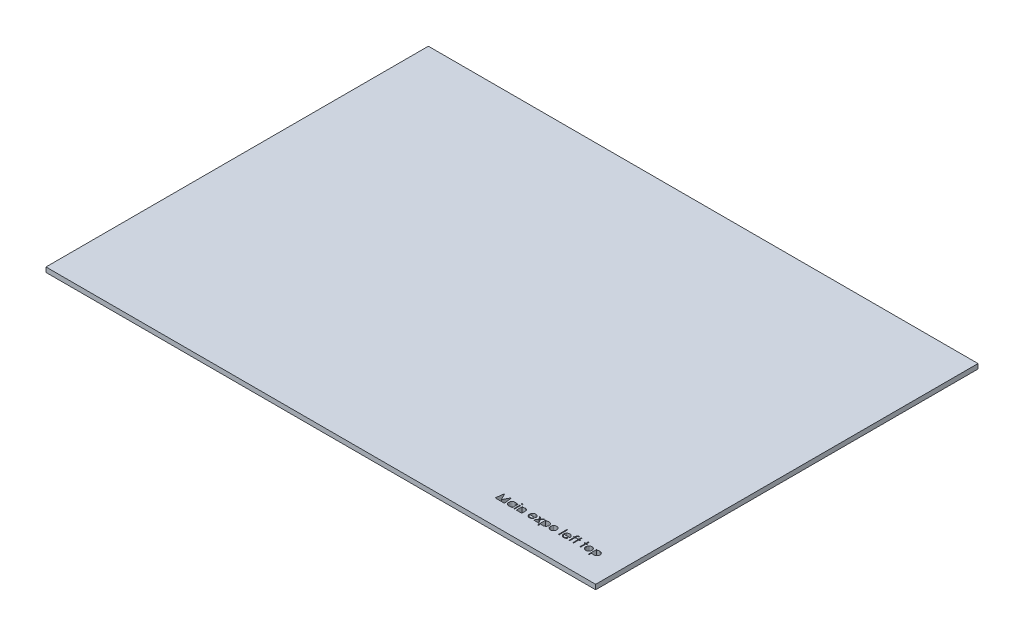
from build123d import *

# Parameters (mm, degrees)
SKETCH1_W           = 230
SKETCH1_H           = 160
SKETCH1_W_2         = 0.314102564
SKETCH1_H_2         = 2.557692307
SKETCH1_W_3         = 0.314102565
SKETCH1_H_3         = 3.589743589
BOSS_EXTRUDE1_DEPTH = 2


with BuildPart() as part:
    # Sketch1 → Boss-Extrude1 (new body)
    with BuildSketch(Plane(origin=(0, 0, 0), x_dir=(1, 0, 0), z_dir=(0, 1, 0))):
        with Locations((115, -80)):
            Rectangle(SKETCH1_W, SKETCH1_H)
        Polygon((177.965507038, -149.71486865), (177.649301108, -149.71486865), (178.111340371, -146.21486865), (178.156212166, -146.21486865), (179.601224185, -149.086663522), (181.042730595, -146.21486865), (181.088303512, -146.21486865), (181.553147262, -149.71486865), (181.237642454, -149.71486865), (179.639084762, -149.71486865), (179.568271461, -149.71486865), align=None, mode=Mode.SUBTRACT)
        with BuildLine():
            add(Edge.make_bspline(
                [(183.425142454, -149.759740445), (183.336113043, -149.759522346), (183.216101969, -149.749093024), (183.099102351, -149.722688544), (183.069311792, -149.71486865)],
                knots=[0, 0, 0, 0, 0.127433484, 0.171490765, 0.171490765, 0.171490765, 0.171490765], degree=3))
            add(Edge.make_bspline(
                [(183.069311792, -149.71486865), (183.057469644, -149.711760138), (183.004620061, -149.69710417), (182.912505577, -149.665310891), (182.796833202, -149.609718503), (182.685773164, -149.543180406), (182.579900472, -149.463938709), (182.480828873, -149.37335092), (182.389597111, -149.274955872), (182.309534977, -149.170010329), (182.242785029, -149.058968068), (182.186953348, -148.943234741), (182.144000303, -148.821920471), (182.103323727, -148.65121329), (182.091816793, -148.518517635), (182.0916088, -148.429011279)],
                knots=[0.171490765, 0.171490765, 0.171490765, 0.171490765, 0.189004127, 0.249930071, 0.310668454, 0.372328961, 0.43493911, 0.499575544, 0.564191208, 0.626735217, 0.688109334, 0.749293607, 0.810330528, 0.87190117, 1, 1, 1, 1], degree=3))
            add(Edge.make_bspline(
                [(182.0916088, -148.429011279), (182.092126454, -148.341193515), (182.102857929, -148.210578964), (182.14485376, -148.042846948), (182.188362727, -147.923491683), (182.244215073, -147.809151185), (182.312140332, -147.699747278), (182.392160243, -147.59497786), (182.484412433, -147.497306591), (182.584347254, -147.407086167), (182.691256, -147.328676426), (182.802479175, -147.260962097), (182.919742592, -147.207299322), (183.041308172, -147.163925058), (183.212520806, -147.123245573), (183.345544927, -147.11310217), (183.434958159, -147.112304548)],
                knots=[0, 0, 0, 0, 0.12607881, 0.186904093, 0.247573935, 0.308003356, 0.369131898, 0.432033228, 0.496790794, 0.561610823, 0.624913866, 0.686726349, 0.748078833, 0.809582291, 0.871630743, 1, 1, 1, 1], degree=3))
            add(Edge.make_bspline(
                [(183.434958159, -147.112304548), (183.537150843, -147.112603518), (183.688894174, -147.125723583), (183.88089195, -147.179702517), (184.015555025, -147.23356415), (184.142691575, -147.305254967), (184.304614576, -147.428409107), (184.407883974, -147.545475683), (184.469813929, -147.630433554)],
                knots=[0, 0, 0, 0, 0.254653531, 0.376014554, 0.495255252, 0.614797719, 0.738105554, 1, 1, 1, 1], degree=3))
            Line((184.469813929, -147.630433554), (184.469813929, -147.157176343))
            Line((184.469813929, -147.157176343), (184.783916493, -147.157176343))
            Line((184.783916493, -147.157176343), (184.783916493, -149.71486865))
            Line((184.783916493, -149.71486865), (184.469813929, -149.71486865))
            Line((184.469813929, -149.71486865), (183.790278782, -149.71486865))
            add(Edge.make_bspline(
                [(183.790278782, -149.71486865), (183.768256051, -149.720549885), (183.648428679, -149.748328797), (183.525378634, -149.760547796), (183.425142454, -149.759740445)],
                knots=[0.69099225, 0.69099225, 0.69099225, 0.69099225, 0.748144942, 1, 1, 1, 1], degree=3))
        make_face(mode=Mode.SUBTRACT)
        with Locations((185.614044698, -148.436022497)):
            Rectangle(SKETCH1_W_2, SKETCH1_H_2, mode=Mode.SUBTRACT)
        with BuildLine():
            add(Edge.make_bspline(
                [(185.322378031, -146.350886279), (185.322218867, -146.315266825), (185.333462047, -146.261854381), (185.369593782, -146.199071076), (185.407025314, -146.158034763), (185.451670306, -146.123829753), (185.518738925, -146.089435859), (185.575239913, -146.080016678), (185.612642454, -146.080253266)],
                knots=[0, 0, 0, 0, 0.242149081, 0.363437476, 0.489745393, 0.618114845, 0.744893781, 1, 1, 1, 1], degree=3))
            add(Edge.make_bspline(
                [(185.612642454, -146.080253266), (185.650640689, -146.080327498), (185.708041629, -146.089025457), (185.775751612, -146.123816518), (185.820339778, -146.158261238), (185.85854178, -146.198820803), (185.894545558, -146.261928351), (185.905912519, -146.315228849), (185.905711364, -146.350886279)],
                knots=[0, 0, 0, 0, 0.258284092, 0.384341125, 0.511979615, 0.638632008, 0.759229763, 1, 1, 1, 1], degree=3))
            add(Edge.make_bspline(
                [(185.905711364, -146.350886279), (185.905785659, -146.385826486), (185.894473068, -146.438289695), (185.858313632, -146.500241415), (185.820364325, -146.54072181), (185.775745138, -146.575147602), (185.708046044, -146.609945307), (185.650638382, -146.618639165), (185.612642454, -146.618714804)],
                knots=[0, 0, 0, 0, 0.23754632, 0.357497051, 0.484917122, 0.613329268, 0.74015037, 1, 1, 1, 1], degree=3))
            add(Edge.make_bspline(
                [(185.612642454, -146.618714804), (185.575242203, -146.61894999), (185.518734544, -146.609534896), (185.451676842, -146.575134313), (185.407000642, -146.540948422), (185.369819423, -146.49999314), (185.333536448, -146.438361874), (185.322344179, -146.385789943), (185.322378031, -146.350886279)],
                knots=[0, 0, 0, 0, 0.256661403, 0.384213213, 0.513365233, 0.640443152, 0.761085005, 1, 1, 1, 1], degree=3))
        make_face(mode=Mode.SUBTRACT)
        with BuildLine():
            Line((186.848019057, -149.71486865), (186.533916493, -149.71486865))
            Line((186.533916493, -149.71486865), (186.533916493, -147.157176343))
            Line((186.533916493, -147.157176343), (186.848019057, -147.157176343))
            Line((186.848019057, -147.157176343), (186.848019057, -147.618514484))
            add(Edge.make_bspline(
                [(186.848019057, -147.618514484), (186.911375861, -147.536307222), (187.012270639, -147.421386619), (187.169589678, -147.3008258), (187.289562224, -147.23069036), (187.415190707, -147.177899117), (187.590692636, -147.126308518), (187.72872643, -147.112780788), (187.821176108, -147.112304548)],
                knots=[0, 0, 0, 0, 0.273568781, 0.398988314, 0.519929781, 0.638110022, 0.756588901, 1, 1, 1, 1], degree=3))
            add(Edge.make_bspline(
                [(187.821176108, -147.112304548), (187.913551754, -147.112916323), (188.051427894, -147.127918797), (188.221999694, -147.190670605), (188.338614153, -147.253828088), (188.443742713, -147.332448996), (188.536067213, -147.42402299), (188.612430547, -147.529360089), (188.663627913, -147.627082993), (188.697353506, -147.713771824), (188.718586051, -147.788018565), (188.736616139, -147.870736719), (188.752251711, -147.961676307), (188.762812676, -148.061474499), (188.774445444, -148.211201076), (188.778286189, -148.327992043), (188.777506236, -148.408678747)],
                knots=[0, 0, 0, 0, 0.15117814, 0.223487984, 0.295542644, 0.366976255, 0.437130525, 0.507043616, 0.578559734, 0.616613545, 0.658756237, 0.704491226, 0.754803115, 0.809331625, 0.868274455, 1, 1, 1, 1], degree=3))
            Line((188.777506236, -148.408678747), (188.777506236, -149.71486865))
            Line((188.777506236, -149.71486865), (188.463403672, -149.71486865))
            Line((188.463403672, -149.71486865), (186.848019057, -149.71486865))
        make_face(mode=Mode.SUBTRACT)
        with BuildLine():
            add(Edge.make_bspline(
                [(192.038423704, -149.759740445), (191.942653024, -149.759701562), (191.81652765, -149.749859854), (191.693628519, -149.722429004), (191.664616456, -149.71486865)],
                knots=[0, 0, 0, 0, 0.139629225, 0.183293708, 0.183293708, 0.183293708, 0.183293708], degree=3))
            add(Edge.make_bspline(
                [(191.664616456, -149.71486865), (191.650329189, -149.711145483), (191.594211678, -149.695474024), (191.499289434, -149.66163325), (191.384546755, -149.604195623), (191.27804601, -149.534238875), (191.179226466, -149.452105879), (191.09120222, -149.357089636), (191.011958501, -149.255407633), (190.942032082, -149.149451732), (190.883576823, -149.039488615), (190.836016243, -148.926217682), (190.797640846, -148.810355306), (190.761559562, -148.649908162), (190.752779938, -148.526056355), (190.751865211, -148.443033715)],
                knots=[0.183293708, 0.183293708, 0.183293708, 0.183293708, 0.204796697, 0.268134963, 0.329813747, 0.391301398, 0.453433515, 0.51655169, 0.579631271, 0.641118921, 0.701294047, 0.760810336, 0.819931722, 0.878919575, 1, 1, 1, 1], degree=3))
            add(Edge.make_bspline(
                [(190.751865211, -148.443033715), (190.752818499, -148.365240012), (190.760094579, -148.249111152), (190.791721958, -148.098567441), (190.823869391, -147.989679749), (190.865448493, -147.8841395), (190.933621269, -147.746628464), (190.998785102, -147.650559192), (191.046336364, -147.589067368)],
                knots=[0, 0, 0, 0, 0.2537679, 0.377428427, 0.500550841, 0.623295883, 0.746578332, 1, 1, 1, 1], degree=3))
            add(Edge.make_bspline(
                [(191.046336364, -147.589067368), (191.106909425, -147.513342819), (191.2056774, -147.407460984), (191.360339552, -147.296698457), (191.481916575, -147.228658912), (191.61225801, -147.177026382), (191.798804036, -147.124531979), (191.946679833, -147.113503128), (192.046136044, -147.112304548)],
                knots=[0, 0, 0, 0, 0.253589335, 0.374643257, 0.495340042, 0.616324775, 0.739759335, 1, 1, 1, 1], degree=3))
            add(Edge.make_bspline(
                [(192.046136044, -147.112304548), (192.148963546, -147.111872574), (192.300871807, -147.12675278), (192.49346487, -147.18004203), (192.627309215, -147.235127662), (192.752978727, -147.306339408), (192.911253903, -147.425410194), (193.014696817, -147.535049884), (193.076083961, -147.615709997)],
                knots=[0, 0, 0, 0, 0.259032841, 0.381879824, 0.502258444, 0.62275219, 0.744742632, 1, 1, 1, 1], degree=3))
            add(Edge.make_bspline(
                [(193.076083961, -147.615709997), (193.121970612, -147.67459882), (193.181879653, -147.770237983), (193.245490421, -147.907024005), (193.283867199, -148.015905739), (193.314877332, -148.12973209), (193.345478815, -148.292088208), (193.352839849, -148.418070547), (193.354429313, -148.503330189)],
                knots=[0, 0, 0, 0, 0.236254763, 0.356174434, 0.477249655, 0.601539871, 0.729618382, 1, 1, 1, 1], degree=3))
            Line((193.354429313, -148.503330189), (191.065967775, -148.503330189))
            add(Edge.make_bspline(
                [(191.065967775, -148.503330189), (191.067756499, -148.5695762), (191.076636846, -148.667432458), (191.106917376, -148.792645749), (191.138163141, -148.879728329), (191.176036056, -148.962658576), (191.222420152, -149.040820585), (191.277760145, -149.11385851), (191.339485724, -149.182425696), (191.408192854, -149.243486268), (191.480475583, -149.298138733), (191.557369186, -149.343941808), (191.638267138, -149.38113107), (191.723039413, -149.410202141), (191.843021478, -149.437268601), (191.936149729, -149.445987566), (191.999160884, -149.445637881)],
                knots=[0, 0, 0, 0, 0.134475588, 0.198391058, 0.260753477, 0.321829223, 0.383037238, 0.444653123, 0.507398011, 0.569825238, 0.630777641, 0.690928687, 0.750945133, 0.811049477, 0.872330853, 1, 1, 1, 1], degree=3))
            add(Edge.make_bspline(
                [(191.999160884, -149.445637881), (192.061354788, -149.445938712), (192.15465102, -149.438615651), (192.276499313, -149.413096069), (192.365760057, -149.387237792), (192.451330868, -149.355652561), (192.530576767, -149.317552049), (192.603455711, -149.275400907), (192.67157733, -149.227194549), (192.73762917, -149.168173224), (192.831126959, -149.063354292), (192.898242728, -148.973723827), (192.940767454, -148.907176343)],
                knots=[0, 0, 0, 0, 0.163878894, 0.24565874, 0.327725695, 0.408609961, 0.485749086, 0.559169056, 0.630268476, 0.705306028, 0.792064966, 1, 1, 1, 1], degree=3))
            Line((192.940767454, -148.907176343), (193.219813929, -149.053710798))
            add(Edge.make_bspline(
                [(193.219813929, -149.053710798), (193.178313092, -149.131403432), (193.108842102, -149.240399318), (193.001896218, -149.370161473), (192.916823225, -149.451907891), (192.827145619, -149.523154841), (192.732415032, -149.585494358), (192.632125716, -149.63861044), (192.527140961, -149.683005323), (192.45440769, -149.705371074), (192.417652088, -149.71486865)],
                knots=[0, 0, 0, 0, 0.181660766, 0.265874227, 0.346354784, 0.424599862, 0.501903184, 0.579992091, 0.658443431, 0.736737234, 0.736737234, 0.736737234, 0.736737234], degree=3))
            add(Edge.make_bspline(
                [(192.417652088, -149.71486865), (192.416743687, -149.71510338), (192.376754708, -149.725388498), (192.251593978, -149.751075064), (192.124717496, -149.759729285), (192.038423704, -149.759740445)],
                knots=[0.736737234, 0.736737234, 0.736737234, 0.736737234, 0.738672236, 0.821894148, 1, 1, 1, 1], degree=3))
        make_face(mode=Mode.SUBTRACT)
        Polygon((193.997357999, -149.71486865), (193.623660082, -149.71486865), (194.603828352, -148.341371054), (193.758275467, -147.157176343), (194.131973384, -147.157176343), (194.790326749, -148.079852625), (195.448680114, -147.157176343), (195.822378031, -147.157176343), (194.977526268, -148.341371054), (195.956993416, -149.71486865), (195.583295499, -149.71486865), align=None, mode=Mode.SUBTRACT)
        with BuildLine():
            Line((196.315967775, -150.657176343), (196.315967775, -149.71486865))
            Line((196.315967775, -149.71486865), (196.315967775, -147.157176343))
            Line((196.315967775, -147.157176343), (196.630070339, -147.157176343))
            Line((196.630070339, -147.157176343), (196.630070339, -147.630433554))
            add(Edge.make_bspline(
                [(196.630070339, -147.630433554), (196.692235574, -147.545124107), (196.796663266, -147.429190528), (196.957941345, -147.305019287), (197.085057115, -147.233589722), (197.219490322, -147.179825965), (197.410725482, -147.125676764), (197.561803201, -147.112625995), (197.663523864, -147.112304548)],
                knots=[0, 0, 0, 0, 0.263044683, 0.386061082, 0.505770653, 0.625178031, 0.746147722, 1, 1, 1, 1], degree=3))
            add(Edge.make_bspline(
                [(197.663523864, -147.112304548), (197.753156595, -147.11320267), (197.886440214, -147.123162409), (198.057874308, -147.16393043), (198.179440666, -147.207297933), (198.296704183, -147.26096232), (198.407926164, -147.32867694), (198.514839738, -147.407083797), (198.614755977, -147.497315766), (198.707077128, -147.594944073), (198.786924097, -147.699966397), (198.85579316, -147.808928868), (198.911473875, -147.923521395), (198.955043264, -148.042838996), (198.997017498, -148.210584475), (199.007762392, -148.341190661), (199.008275467, -148.429011279)],
                knots=[0, 0, 0, 0, 0.128636051, 0.190652902, 0.252125037, 0.313446276, 0.375227279, 0.438498083, 0.5032851, 0.568009687, 0.630878982, 0.692153504, 0.75255215, 0.813191094, 0.8739854, 1, 1, 1, 1], degree=3))
            add(Edge.make_bspline(
                [(199.008275467, -148.429011279), (199.008072228, -148.518520529), (198.996551415, -148.651207733), (198.955897046, -148.821928437), (198.912882242, -148.9432051), (198.857229124, -149.059188911), (198.78952771, -149.169795268), (198.70964038, -149.274988967), (198.61833949, -149.373341926), (198.519286496, -149.463941007), (198.413409002, -149.543179913), (198.302350148, -149.609718248), (198.186677702, -149.66531237), (198.094567052, -149.697098632), (198.041722984, -149.711759961), (198.029885635, -149.71486865)],
                knots=[0, 0, 0, 0, 0.128034164, 0.189573725, 0.250579835, 0.311733221, 0.37325008, 0.435762516, 0.500345561, 0.564949367, 0.627527909, 0.68915729, 0.749865012, 0.8107602, 0.828257924, 0.828257924, 0.828257924, 0.828257924], degree=3))
            add(Edge.make_bspline(
                [(198.029885635, -149.71486865), (198.000090983, -149.722693233), (197.882861945, -149.749158758), (197.76258718, -149.759417729), (197.67333957, -149.759740445)],
                knots=[0.828257924, 0.828257924, 0.828257924, 0.828257924, 0.872299761, 1, 1, 1, 1], degree=3))
            add(Edge.make_bspline(
                [(197.67333957, -149.759740445), (197.572869361, -149.760900358), (197.454853326, -149.747260761), (197.339951816, -149.719417796), (197.322727919, -149.71486865)],
                knots=[0, 0, 0, 0, 0.250547782, 0.295016817, 0.295016817, 0.295016817, 0.295016817], degree=3))
            Line((197.322727919, -149.71486865), (196.630070339, -149.71486865))
            Line((196.630070339, -149.71486865), (196.630070339, -150.657176343))
            Line((196.630070339, -150.657176343), (196.315967775, -150.657176343))
        make_face(mode=Mode.SUBTRACT)
        with BuildLine():
            add(Edge.make_bspline(
                [(200.871857198, -149.759740445), (200.778451581, -149.759318353), (200.653507084, -149.749816508), (200.531675578, -149.722769789), (200.5015059, -149.71486865)],
                knots=[0, 0, 0, 0, 0.134635192, 0.179537829, 0.179537829, 0.179537829, 0.179537829], degree=3))
            add(Edge.make_bspline(
                [(200.5015059, -149.71486865), (200.488883515, -149.711562974), (200.434495011, -149.696398611), (200.340687753, -149.663032428), (200.223542484, -149.607728118), (200.113756095, -149.539119038), (200.010556169, -149.458558174), (199.915484118, -149.366422433), (199.829485787, -149.266412424), (199.753611785, -149.1612624), (199.689725065, -149.051852297), (199.637353672, -148.937969637), (199.596571043, -148.820110815), (199.557939445, -148.655722025), (199.546230098, -148.528601132), (199.546737005, -148.443033715)],
                knots=[0.179537829, 0.179537829, 0.179537829, 0.179537829, 0.198324187, 0.260825013, 0.322713588, 0.384554535, 0.446912858, 0.510957633, 0.574930701, 0.636684538, 0.697483115, 0.757133808, 0.816965664, 0.876818352, 1, 1, 1, 1], degree=3))
            add(Edge.make_bspline(
                [(199.546737005, -148.443033715), (199.547231272, -148.358326917), (199.556778888, -148.232334603), (199.593791774, -148.069823715), (199.632482489, -147.953893019), (199.682030841, -147.842161293), (199.763186115, -147.697408346), (199.840884603, -147.59829301), (199.897297903, -147.535782112)],
                knots=[0, 0, 0, 0, 0.255237725, 0.378678596, 0.501087887, 0.622713679, 0.746240795, 1, 1, 1, 1], degree=3))
            add(Edge.make_bspline(
                [(199.897297903, -147.535782112), (199.958916592, -147.466937294), (200.06143706, -147.37509618), (200.213439287, -147.275575768), (200.333120625, -147.216044393), (200.458815306, -147.169272743), (200.637663927, -147.124926614), (200.777289891, -147.111441192), (200.871857198, -147.112304548)],
                knots=[0, 0, 0, 0, 0.252712986, 0.374819133, 0.496436426, 0.617910557, 0.741287617, 1, 1, 1, 1], degree=3))
            add(Edge.make_bspline(
                [(200.871857198, -147.112304548), (200.965947359, -147.111329907), (201.105173532, -147.124895589), (201.28329866, -147.16953956), (201.409094574, -147.214745473), (201.527474218, -147.275473685), (201.679838216, -147.373020016), (201.781453521, -147.465742141), (201.843612005, -147.533678747)],
                knots=[0, 0, 0, 0, 0.258332351, 0.382133976, 0.503804392, 0.624692987, 0.74687059, 1, 1, 1, 1], degree=3))
            add(Edge.make_bspline(
                [(201.843612005, -147.533678747), (201.900643015, -147.596016667), (201.977037079, -147.695955107), (202.059276479, -147.840315898), (202.108380553, -147.952534404), (202.147022723, -148.068915605), (202.184214705, -148.231854905), (202.193698514, -148.358096868), (202.194172903, -148.443033715)],
                knots=[0, 0, 0, 0, 0.253834363, 0.376505623, 0.498533686, 0.621367729, 0.744564745, 1, 1, 1, 1], degree=3))
            add(Edge.make_bspline(
                [(202.194172903, -148.443033715), (202.194679812, -148.528601135), (202.18297046, -148.655722019), (202.144338871, -148.820110823), (202.103556216, -148.937969607), (202.051184918, -149.051852409), (201.987297837, -149.161261969), (201.911425225, -149.266414086), (201.825421504, -149.366415979), (201.730369561, -149.458581992), (201.627253404, -149.538910993), (201.518099467, -149.607729837), (201.401455732, -149.663176284), (201.307806886, -149.696408713), (201.253402356, -149.711562035), (201.240767507, -149.71486865)],
                knots=[0, 0, 0, 0, 0.123336979, 0.18326514, 0.243172443, 0.302898354, 0.363773598, 0.425605305, 0.489659043, 0.553784577, 0.616221533, 0.677854471, 0.739516897, 0.802096536, 0.820924402, 0.820924402, 0.820924402, 0.820924402], degree=3))
            add(Edge.make_bspline(
                [(201.240767507, -149.71486865), (201.210608576, -149.722761422), (201.089250662, -149.749715358), (200.964807247, -149.75937648), (200.871857198, -149.759740445)],
                knots=[0.820924402, 0.820924402, 0.820924402, 0.820924402, 0.865865841, 1, 1, 1, 1], degree=3))
        make_face(mode=Mode.SUBTRACT)
        with Locations((204.280711365, -147.919996856)):
            Rectangle(SKETCH1_W_3, SKETCH1_H_3, mode=Mode.SUBTRACT)
        with BuildLine():
            add(Edge.make_bspline(
                [(206.352526268, -149.759740445), (206.256755588, -149.759701562), (206.130630214, -149.749859854), (206.007731083, -149.722429004), (205.97871902, -149.71486865)],
                knots=[0, 0, 0, 0, 0.139629225, 0.183293708, 0.183293708, 0.183293708, 0.183293708], degree=3))
            add(Edge.make_bspline(
                [(205.97871902, -149.71486865), (205.964431754, -149.711145483), (205.908314242, -149.695474024), (205.813391998, -149.66163325), (205.698649319, -149.604195623), (205.592148575, -149.534238875), (205.49332903, -149.452105879), (205.405304784, -149.357089636), (205.326061065, -149.255407633), (205.256134646, -149.149451732), (205.197679387, -149.039488615), (205.150118807, -148.926217682), (205.111743411, -148.810355306), (205.075662126, -148.649908162), (205.066882502, -148.526056355), (205.065967775, -148.443033715)],
                knots=[0.183293708, 0.183293708, 0.183293708, 0.183293708, 0.204796697, 0.268134963, 0.329813747, 0.391301398, 0.453433515, 0.51655169, 0.579631271, 0.641118921, 0.701294047, 0.760810336, 0.819931722, 0.878919575, 1, 1, 1, 1], degree=3))
            add(Edge.make_bspline(
                [(205.065967775, -148.443033715), (205.066921063, -148.365240012), (205.074197143, -148.249111152), (205.105824523, -148.098567441), (205.137971955, -147.989679749), (205.179551057, -147.8841395), (205.247723833, -147.746628464), (205.312887666, -147.650559192), (205.360438929, -147.589067368)],
                knots=[0, 0, 0, 0, 0.2537679, 0.377428427, 0.500550841, 0.623295883, 0.746578332, 1, 1, 1, 1], degree=3))
            add(Edge.make_bspline(
                [(205.360438929, -147.589067368), (205.421011989, -147.513342819), (205.519779964, -147.407460984), (205.674442116, -147.296698457), (205.796019139, -147.228658912), (205.926360574, -147.177026382), (206.1129066, -147.124531979), (206.260782397, -147.113503128), (206.360238608, -147.112304548)],
                knots=[0, 0, 0, 0, 0.253589335, 0.374643257, 0.495340042, 0.616324775, 0.739759335, 1, 1, 1, 1], degree=3))
            add(Edge.make_bspline(
                [(206.360238608, -147.112304548), (206.46306611, -147.111872574), (206.614974371, -147.12675278), (206.807567434, -147.18004203), (206.94141178, -147.235127662), (207.067081291, -147.306339408), (207.225356467, -147.425410194), (207.328799381, -147.535049884), (207.390186525, -147.615709997)],
                knots=[0, 0, 0, 0, 0.259032841, 0.381879824, 0.502258444, 0.62275219, 0.744742632, 1, 1, 1, 1], degree=3))
            add(Edge.make_bspline(
                [(207.390186525, -147.615709997), (207.436073177, -147.67459882), (207.495982217, -147.770237983), (207.559592985, -147.907024005), (207.597969763, -148.015905739), (207.628979896, -148.12973209), (207.659581379, -148.292088208), (207.666942413, -148.418070547), (207.668531877, -148.503330189)],
                knots=[0, 0, 0, 0, 0.236254763, 0.356174434, 0.477249655, 0.601539871, 0.729618382, 1, 1, 1, 1], degree=3))
            Line((207.668531877, -148.503330189), (205.380070339, -148.503330189))
            add(Edge.make_bspline(
                [(205.380070339, -148.503330189), (205.381859063, -148.5695762), (205.39073941, -148.667432458), (205.42101994, -148.792645749), (205.452265705, -148.879728329), (205.49013862, -148.962658576), (205.536522716, -149.040820585), (205.591862709, -149.11385851), (205.653588288, -149.182425696), (205.722295418, -149.243486268), (205.794578147, -149.298138733), (205.87147175, -149.343941808), (205.952369702, -149.38113107), (206.037141977, -149.410202141), (206.157124043, -149.437268601), (206.250252293, -149.445987566), (206.313263448, -149.445637881)],
                knots=[0, 0, 0, 0, 0.134475588, 0.198391058, 0.260753477, 0.321829223, 0.383037238, 0.444653123, 0.507398011, 0.569825238, 0.630777641, 0.690928687, 0.750945133, 0.811049477, 0.872330853, 1, 1, 1, 1], degree=3))
            add(Edge.make_bspline(
                [(206.313263448, -149.445637881), (206.375457352, -149.445938712), (206.468753584, -149.438615651), (206.590601878, -149.413096069), (206.679862621, -149.387237792), (206.765433433, -149.355652561), (206.844679331, -149.317552049), (206.917558275, -149.275400907), (206.985679894, -149.227194549), (207.051731734, -149.168173224), (207.145229523, -149.063354292), (207.212345292, -148.973723827), (207.254870018, -148.907176343)],
                knots=[0, 0, 0, 0, 0.163878894, 0.24565874, 0.327725695, 0.408609961, 0.485749086, 0.559169056, 0.630268476, 0.705306028, 0.792064966, 1, 1, 1, 1], degree=3))
            Line((207.254870018, -148.907176343), (207.533916493, -149.053710798))
            add(Edge.make_bspline(
                [(207.533916493, -149.053710798), (207.492415657, -149.131403432), (207.422944666, -149.240399318), (207.315998782, -149.370161473), (207.230925789, -149.451907891), (207.141248183, -149.523154841), (207.046517596, -149.585494358), (206.94622828, -149.63861044), (206.841243525, -149.683005323), (206.768510255, -149.705371074), (206.731754652, -149.71486865)],
                knots=[0, 0, 0, 0, 0.181660766, 0.265874227, 0.346354784, 0.424599862, 0.501903184, 0.579992091, 0.658443431, 0.736737234, 0.736737234, 0.736737234, 0.736737234], degree=3))
            add(Edge.make_bspline(
                [(206.731754652, -149.71486865), (206.730846251, -149.71510338), (206.690857272, -149.725388498), (206.565696542, -149.751075064), (206.43882006, -149.759729285), (206.352526268, -149.759740445)],
                knots=[0.736737234, 0.736737234, 0.736737234, 0.736737234, 0.738672236, 0.821894148, 1, 1, 1, 1], degree=3))
        make_face(mode=Mode.SUBTRACT)
        with BuildLine():
            Line((208.790326749, -149.71486865), (208.476224185, -149.71486865))
            Line((208.476224185, -149.71486865), (208.476224185, -147.471278907))
            Line((208.476224185, -147.471278907), (208.117249826, -147.471278907))
            Line((208.117249826, -147.471278907), (208.117249826, -147.157176343))
            Line((208.117249826, -147.157176343), (208.476224185, -147.157176343))
            Line((208.476224185, -147.157176343), (208.476224185, -146.748422336))
            add(Edge.make_bspline(
                [(208.476224185, -146.748422336), (208.47537371, -146.704893758), (208.478481234, -146.642282753), (208.482592666, -146.561813296), (208.488346391, -146.509224235), (208.495011276, -146.46137819), (208.504546698, -146.418985286), (208.513558236, -146.380903534), (208.529906785, -146.337800865), (208.554329012, -146.288950915), (208.593859253, -146.237326713), (208.641252066, -146.191022928), (208.697861169, -146.152010956), (208.761573608, -146.119613818), (208.858826785, -146.087630764), (208.93753646, -146.081163123), (208.990847582, -146.080253266)],
                knots=[0, 0, 0, 0, 0.133856433, 0.192947832, 0.247915963, 0.29664228, 0.341504354, 0.381630214, 0.416904813, 0.483173328, 0.548916672, 0.616061618, 0.68630213, 0.759645114, 0.835389552, 1, 1, 1, 1], degree=3))
            add(Edge.make_bspline(
                [(208.990847582, -146.080253266), (209.049801606, -146.080936807), (209.179618546, -146.093006759), (209.305500242, -146.126854574), (209.373660082, -146.146158715)],
                knots=[0, 0, 0, 0, 0.453862855, 1, 1, 1, 1], degree=3))
            Line((209.373660082, -146.146158715), (209.373660082, -146.472881471))
            add(Edge.make_bspline(
                [(209.373660082, -146.472881471), (209.31761399, -146.449473001), (209.213869347, -146.41167543), (209.104623633, -146.394543826), (209.055350788, -146.39435583)],
                knots=[0, 0, 0, 0, 0.553028173, 1, 1, 1, 1], degree=3))
            add(Edge.make_bspline(
                [(209.055350788, -146.39435583), (209.025206947, -146.395506176), (208.980684564, -146.397706871), (208.926442703, -146.415800497), (208.891540319, -146.432827943), (208.862589083, -146.454182566), (208.837803036, -146.475637729), (208.819836468, -146.499822933), (208.810081519, -146.522343338), (208.804131543, -146.543194333), (208.802341291, -146.564548596), (208.797957031, -146.590772697), (208.796731039, -146.622936344), (208.793958837, -146.660039391), (208.794211597, -146.720638475), (208.790952353, -146.768482974), (208.792430114, -146.802408715)],
                knots=[0, 0, 0, 0, 0.158723881, 0.22942429, 0.297719362, 0.360776094, 0.416987544, 0.468545574, 0.516674948, 0.54453398, 0.581509313, 0.628334039, 0.683432546, 0.749506043, 0.822818186, 1, 1, 1, 1], degree=3))
            Line((208.792430114, -146.802408715), (208.792430114, -147.157176343))
            Line((208.792430114, -147.157176343), (209.328788288, -147.157176343))
            Line((209.328788288, -147.157176343), (209.328788288, -147.471278907))
            Line((209.328788288, -147.471278907), (208.791728993, -147.471278907))
            Line((208.791728993, -147.471278907), (208.790326749, -149.71486865))
        make_face(mode=Mode.SUBTRACT)
        Polygon((210.450583159, -149.71486865), (210.136480595, -149.71486865), (210.136480595, -147.471278907), (209.687762647, -147.471278907), (209.687762647, -147.157176343), (210.136480595, -147.157176343), (210.136480595, -146.125125061), (210.450583159, -146.125125061), (210.450583159, -147.157176343), (210.899301108, -147.157176343), (210.899301108, -147.471278907), (210.450583159, -147.471278907), align=None, mode=Mode.SUBTRACT)
        Polygon((213.412121621, -149.71486865), (213.098019057, -149.71486865), (213.098019057, -147.471278907), (212.649301108, -147.471278907), (212.649301108, -147.157176343), (213.098019057, -147.157176343), (213.098019057, -146.125125061), (213.412121621, -146.125125061), (213.412121621, -147.157176343), (213.86083957, -147.157176343), (213.86083957, -147.471278907), (213.412121621, -147.471278907), align=None, mode=Mode.SUBTRACT)
        with BuildLine():
            Line((217.585198544, -150.657176343), (217.585198544, -149.71486865))
            Line((217.585198544, -149.71486865), (217.585198544, -147.157176343))
            Line((217.585198544, -147.157176343), (217.899301108, -147.157176343))
            Line((217.899301108, -147.157176343), (217.899301108, -147.630433554))
            add(Edge.make_bspline(
                [(217.899301108, -147.630433554), (217.961466343, -147.545124107), (218.065894036, -147.429190528), (218.227172114, -147.305019287), (218.354287884, -147.233589722), (218.488721091, -147.179825965), (218.679956252, -147.125676764), (218.83103397, -147.112625995), (218.932754634, -147.112304548)],
                knots=[0, 0, 0, 0, 0.263044683, 0.386061082, 0.505770653, 0.625178031, 0.746147722, 1, 1, 1, 1], degree=3))
            add(Edge.make_bspline(
                [(218.932754634, -147.112304548), (219.022387364, -147.11320267), (219.155670983, -147.123162409), (219.327105077, -147.16393043), (219.448671435, -147.207297933), (219.565934952, -147.26096232), (219.677156933, -147.32867694), (219.784070507, -147.407083797), (219.883986746, -147.497315766), (219.976307897, -147.594944073), (220.056154867, -147.699966397), (220.125023929, -147.808928868), (220.180704644, -147.923521395), (220.224274033, -148.042838996), (220.266248268, -148.210584475), (220.276993162, -148.341190661), (220.277506236, -148.429011279)],
                knots=[0, 0, 0, 0, 0.128636051, 0.190652902, 0.252125037, 0.313446276, 0.375227279, 0.438498083, 0.5032851, 0.568009687, 0.630878982, 0.692153504, 0.75255215, 0.813191094, 0.8739854, 1, 1, 1, 1], degree=3))
            add(Edge.make_bspline(
                [(220.277506236, -148.429011279), (220.277302997, -148.518520529), (220.265782184, -148.651207733), (220.225127815, -148.821928437), (220.182113011, -148.9432051), (220.126459894, -149.059188911), (220.058758479, -149.169795268), (219.978871149, -149.274988967), (219.88757026, -149.373341926), (219.788517265, -149.463941007), (219.682639771, -149.543179913), (219.571580918, -149.609718248), (219.455908471, -149.66531237), (219.363797821, -149.697098632), (219.310953753, -149.711759961), (219.299116404, -149.71486865)],
                knots=[0, 0, 0, 0, 0.128034164, 0.189573725, 0.250579835, 0.311733221, 0.37325008, 0.435762516, 0.500345561, 0.564949367, 0.627527909, 0.68915729, 0.749865012, 0.8107602, 0.828257924, 0.828257924, 0.828257924, 0.828257924], degree=3))
            add(Edge.make_bspline(
                [(219.299116404, -149.71486865), (219.269321752, -149.722693233), (219.152092714, -149.749158758), (219.03181795, -149.759417729), (218.942570339, -149.759740445)],
                knots=[0.828257924, 0.828257924, 0.828257924, 0.828257924, 0.872299761, 1, 1, 1, 1], degree=3))
            add(Edge.make_bspline(
                [(218.942570339, -149.759740445), (218.842100131, -149.760900358), (218.724084096, -149.747260761), (218.609182585, -149.719417796), (218.591958688, -149.71486865)],
                knots=[0, 0, 0, 0, 0.250547782, 0.295016817, 0.295016817, 0.295016817, 0.295016817], degree=3))
            Line((218.591958688, -149.71486865), (217.899301108, -149.71486865))
            Line((217.899301108, -149.71486865), (217.899301108, -150.657176343))
            Line((217.899301108, -150.657176343), (217.585198544, -150.657176343))
        make_face(mode=Mode.SUBTRACT)
        with BuildLine():
            add(Edge.make_bspline(
                [(215.634677711, -149.759740445), (215.541272094, -149.759318353), (215.416327597, -149.749816508), (215.29449609, -149.722769789), (215.264326412, -149.71486865)],
                knots=[0, 0, 0, 0, 0.134635192, 0.179537829, 0.179537829, 0.179537829, 0.179537829], degree=3))
            add(Edge.make_bspline(
                [(215.264326412, -149.71486865), (215.251704028, -149.711562974), (215.197315524, -149.696398611), (215.103508265, -149.663032428), (214.986362997, -149.607728118), (214.876576608, -149.539119038), (214.773376681, -149.458558174), (214.678304631, -149.366422433), (214.5923063, -149.266412424), (214.516432298, -149.1612624), (214.452545578, -149.051852297), (214.400174185, -148.937969637), (214.359391556, -148.820110815), (214.320759958, -148.655722025), (214.309050611, -148.528601132), (214.309557518, -148.443033715)],
                knots=[0.179537829, 0.179537829, 0.179537829, 0.179537829, 0.198324187, 0.260825013, 0.322713588, 0.384554535, 0.446912858, 0.510957633, 0.574930701, 0.636684538, 0.697483115, 0.757133808, 0.816965664, 0.876818352, 1, 1, 1, 1], degree=3))
            add(Edge.make_bspline(
                [(214.309557518, -148.443033715), (214.310051785, -148.358326917), (214.319599401, -148.232334603), (214.356612286, -148.069823715), (214.395303002, -147.953893019), (214.444851353, -147.842161293), (214.526006628, -147.697408346), (214.603705116, -147.59829301), (214.660118416, -147.535782112)],
                knots=[0, 0, 0, 0, 0.255237725, 0.378678596, 0.501087887, 0.622713679, 0.746240795, 1, 1, 1, 1], degree=3))
            add(Edge.make_bspline(
                [(214.660118416, -147.535782112), (214.721737105, -147.466937294), (214.824257573, -147.37509618), (214.976259799, -147.275575768), (215.095941138, -147.216044393), (215.221635819, -147.169272743), (215.40048444, -147.124926614), (215.540110403, -147.111441192), (215.634677711, -147.112304548)],
                knots=[0, 0, 0, 0, 0.252712986, 0.374819133, 0.496436426, 0.617910557, 0.741287617, 1, 1, 1, 1], degree=3))
            add(Edge.make_bspline(
                [(215.634677711, -147.112304548), (215.728767872, -147.111329907), (215.867994045, -147.124895589), (216.046119173, -147.16953956), (216.171915087, -147.214745473), (216.290294731, -147.275473685), (216.442658728, -147.373020016), (216.544274034, -147.465742141), (216.606432518, -147.533678747)],
                knots=[0, 0, 0, 0, 0.258332351, 0.382133976, 0.503804392, 0.624692987, 0.74687059, 1, 1, 1, 1], degree=3))
            add(Edge.make_bspline(
                [(216.606432518, -147.533678747), (216.663463528, -147.596016667), (216.739857591, -147.695955107), (216.822096991, -147.840315898), (216.871201066, -147.952534404), (216.909843236, -148.068915605), (216.947035218, -148.231854905), (216.956519027, -148.358096868), (216.956993416, -148.443033715)],
                knots=[0, 0, 0, 0, 0.253834363, 0.376505623, 0.498533686, 0.621367729, 0.744564745, 1, 1, 1, 1], degree=3))
            add(Edge.make_bspline(
                [(216.956993416, -148.443033715), (216.957500325, -148.528601135), (216.945790972, -148.655722019), (216.907159384, -148.820110823), (216.866376729, -148.937969607), (216.81400543, -149.051852409), (216.75011835, -149.161261969), (216.674245738, -149.266414086), (216.588242017, -149.366415979), (216.493190073, -149.458581992), (216.390073917, -149.538910993), (216.28091998, -149.607729837), (216.164276245, -149.663176284), (216.070627399, -149.696408713), (216.016222869, -149.711562035), (216.00358802, -149.71486865)],
                knots=[0, 0, 0, 0, 0.123336979, 0.18326514, 0.243172443, 0.302898354, 0.363773598, 0.425605305, 0.489659043, 0.553784577, 0.616221533, 0.677854471, 0.739516897, 0.802096536, 0.820924402, 0.820924402, 0.820924402, 0.820924402], degree=3))
            add(Edge.make_bspline(
                [(216.00358802, -149.71486865), (215.973429089, -149.722761422), (215.852071175, -149.749715358), (215.72762776, -149.75937648), (215.634677711, -149.759740445)],
                knots=[0.820924402, 0.820924402, 0.820924402, 0.820924402, 0.865865841, 1, 1, 1, 1], degree=3))
        make_face(mode=Mode.SUBTRACT)
    extrude(amount=BOSS_EXTRUDE1_DEPTH)


solid = part.part
